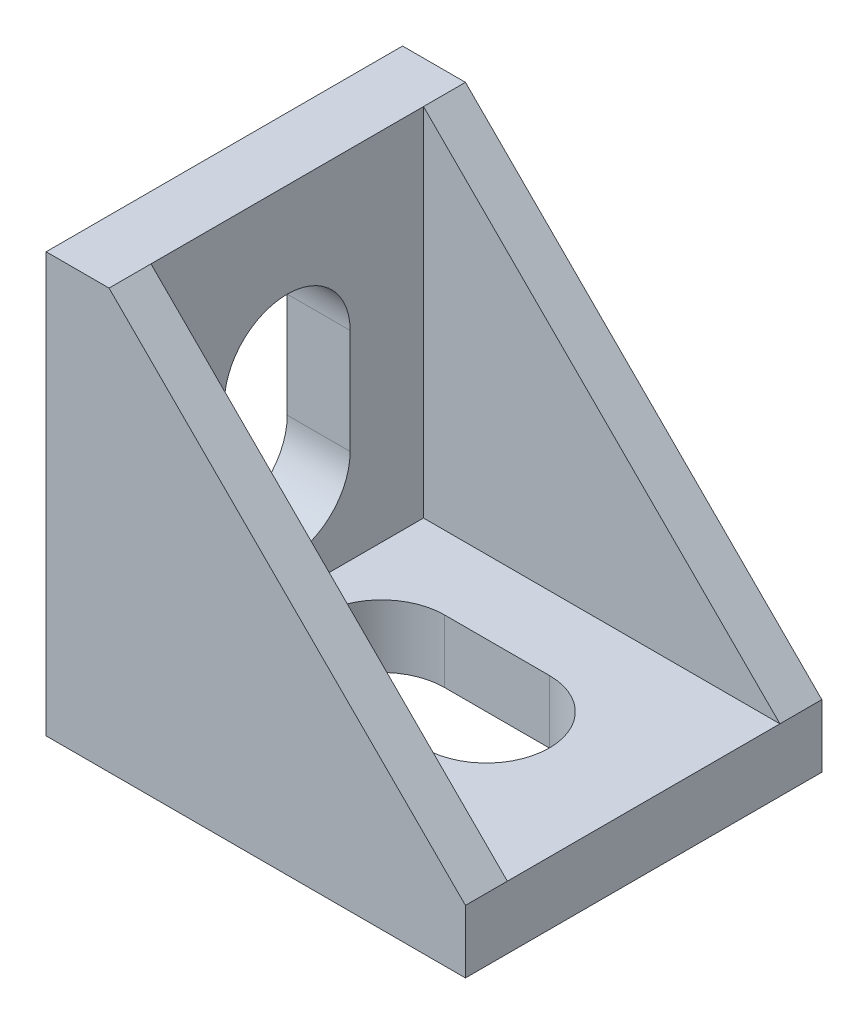
from build123d import *

# Parameters (mm, degrees)
SKETCH_1_W          = 20
SKETCH_1_H          = 17
EXTRUDE_1_DEPTH     = 3
SKETCH_4_W          = 17
SKETCH_4_H          = 20
EXTRUDE_2_DEPTH     = 3
EXTRUDE_3_DEPTH     = 2
EXTRUDE_4_DEPTH     = 2
CUT_EXTRUDE_2_DEPTH = 12
EXTRUDE_6_DEPTH     = 1
EXTRUDE_7_DEPTH     = 1


with BuildPart() as part:
    # 草图1 → 凸台-拉伸1 (new body)
    with BuildSketch(Plane(origin=(0, 0, 0), x_dir=(1, 0, 0), z_dir=(0, 1, 0))):
        with Locations((0.384615385, 1.297202797)):
            Rectangle(SKETCH_1_W, SKETCH_1_H)
        with BuildLine():
            Line((-2.115384615, 4.297202797), (2.884615385, 4.297202797))
            ThreePointArc((2.884615385, 4.297202797), (5.884615385, 1.297202797), (2.884615385, -1.702797203))
            Line((2.884615385, -1.702797203), (-2.115384615, -1.702797203))
            ThreePointArc((-2.115384615, -1.702797203), (-5.115384615, 1.297202797), (-2.115384615, 4.297202797))
        make_face(mode=Mode.SUBTRACT)
    extrude(amount=EXTRUDE_1_DEPTH)

    # 草图4 → 凸台-拉伸2 (add)
    with BuildSketch(Plane.ZY.offset(9.615384615)):
        with Locations((-1.297202797, 10)):
            Rectangle(SKETCH_4_W, SKETCH_4_H)
    extrude(amount=-EXTRUDE_2_DEPTH)

    # 草图6 → 凸台-拉伸3 (add)
    with BuildSketch(Plane.XY.offset(7.202797203)):
        Polygon((-6.615384615, 20), (10.384615385, 3), (-6.615384615, 3), align=None)
    extrude(amount=-EXTRUDE_3_DEPTH)

    # 草图7 → 凸台-拉伸4 (add)
    with BuildSketch(Plane(origin=(0, 0, -9.797202797), x_dir=(-1, 0, 0), z_dir=(0, 0, -1))):
        Polygon((6.615384615, 20), (6.615384615, 3), (-10.384615385, 3), align=None)
    extrude(amount=-EXTRUDE_4_DEPTH)

    # 草图5 → 切除-拉伸2 (cut)
    with BuildSketch(Plane(origin=(-6.615384615, 0, 0), x_dir=(0, 0, -1), z_dir=(1, 0, 0))):
        with BuildLine():
            Line((4.297202797, 12.5), (4.297202797, 7.5))
            ThreePointArc((4.297202797, 7.5), (1.297202797, 4.5), (-1.702797203, 7.5))
            Line((-1.702797203, 7.5), (-1.702797203, 12.5))
            ThreePointArc((-1.702797203, 12.5), (1.297202797, 15.5), (4.297202797, 12.5))
        make_face()
    extrude(amount=-CUT_EXTRUDE_2_DEPTH, mode=Mode.SUBTRACT)

    # 草图9 → 凸台-拉伸6 (add)
    with BuildSketch(Plane.ZY.offset(9.615384615)):
        with BuildLine():
            Line((-2.197202797, 18.65), (-0.397202797, 18.65))
            ThreePointArc((-0.397202797, 18.65), (0.502797203, 17.75), (-0.397202797, 16.85))
            Line((-0.397202797, 16.85), (-2.197202797, 16.85))
            ThreePointArc((-2.197202797, 16.85), (-3.097202797, 17.75), (-2.197202797, 18.65))
        make_face()
        with BuildLine():
            Line((-2.197202797, 3.15), (-0.397202797, 3.15))
            ThreePointArc((-0.397202797, 3.15), (0.502797203, 2.25), (-0.397202797, 1.35))
            Line((-0.397202797, 1.35), (-2.197202797, 1.35))
            ThreePointArc((-2.197202797, 1.35), (-3.097202797, 2.25), (-2.197202797, 3.15))
        make_face()
    extrude(amount=EXTRUDE_6_DEPTH)

    # 草图10 → 凸台-拉伸7 (add)
    with BuildSketch(Plane.XZ):
        with BuildLine():
            Line((-6.465384615, -0.397202797), (-6.465384615, -2.197202797))
            ThreePointArc((-6.465384615, -2.197202797), (-7.365384615, -3.097202797), (-8.265384615, -2.197202797))
            Line((-8.265384615, -2.197202797), (-8.265384615, -0.397202797))
            ThreePointArc((-8.265384615, -0.397202797), (-7.365384615, 0.502797203), (-6.465384615, -0.397202797))
        make_face()
        with BuildLine():
            Line((9.034615385, -0.397202797), (9.034615385, -2.197202797))
            ThreePointArc((9.034615385, -2.197202797), (8.134615385, -3.097202797), (7.234615385, -2.197202797))
            Line((7.234615385, -2.197202797), (7.234615385, -0.397202797))
            ThreePointArc((7.234615385, -0.397202797), (8.134615385, 0.502797203), (9.034615385, -0.397202797))
        make_face()
    extrude(amount=EXTRUDE_7_DEPTH)


solid = part.part
